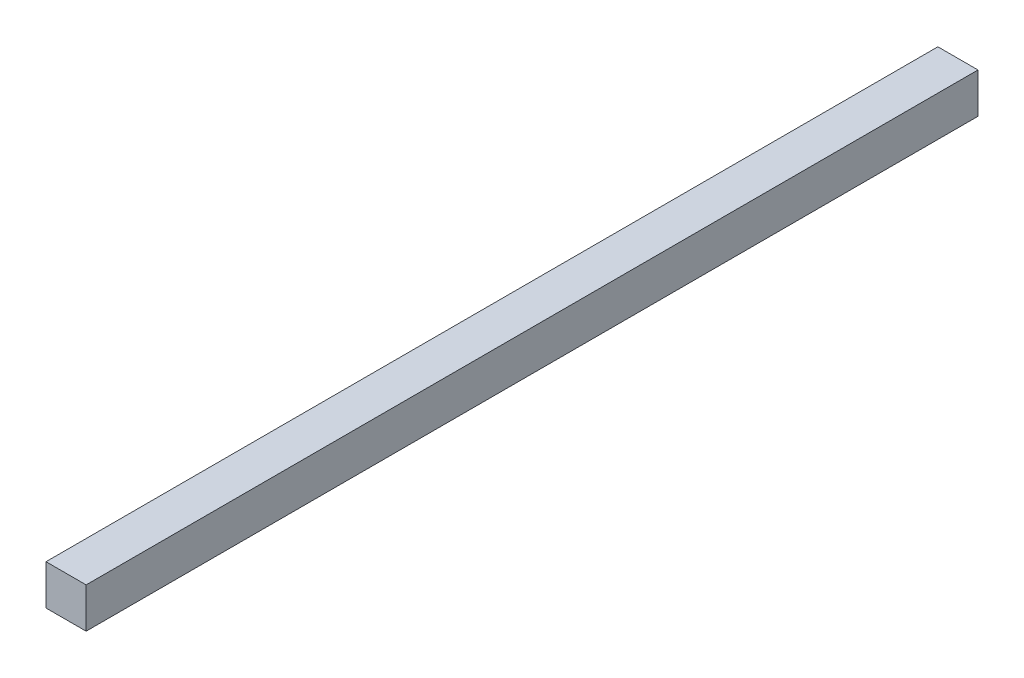
from build123d import *

# Parameters (mm, degrees)
SKETCH1_W           = 18
SKETCH1_H           = 18
BOSS_EXTRUDE1_DEPTH = 400


with BuildPart() as part:
    # Sketch1 → Boss-Extrude1 (new body)
    with BuildSketch(Plane.XY):
        Rectangle(SKETCH1_W, SKETCH1_H)
    extrude(amount=BOSS_EXTRUDE1_DEPTH)


solid = part.part
